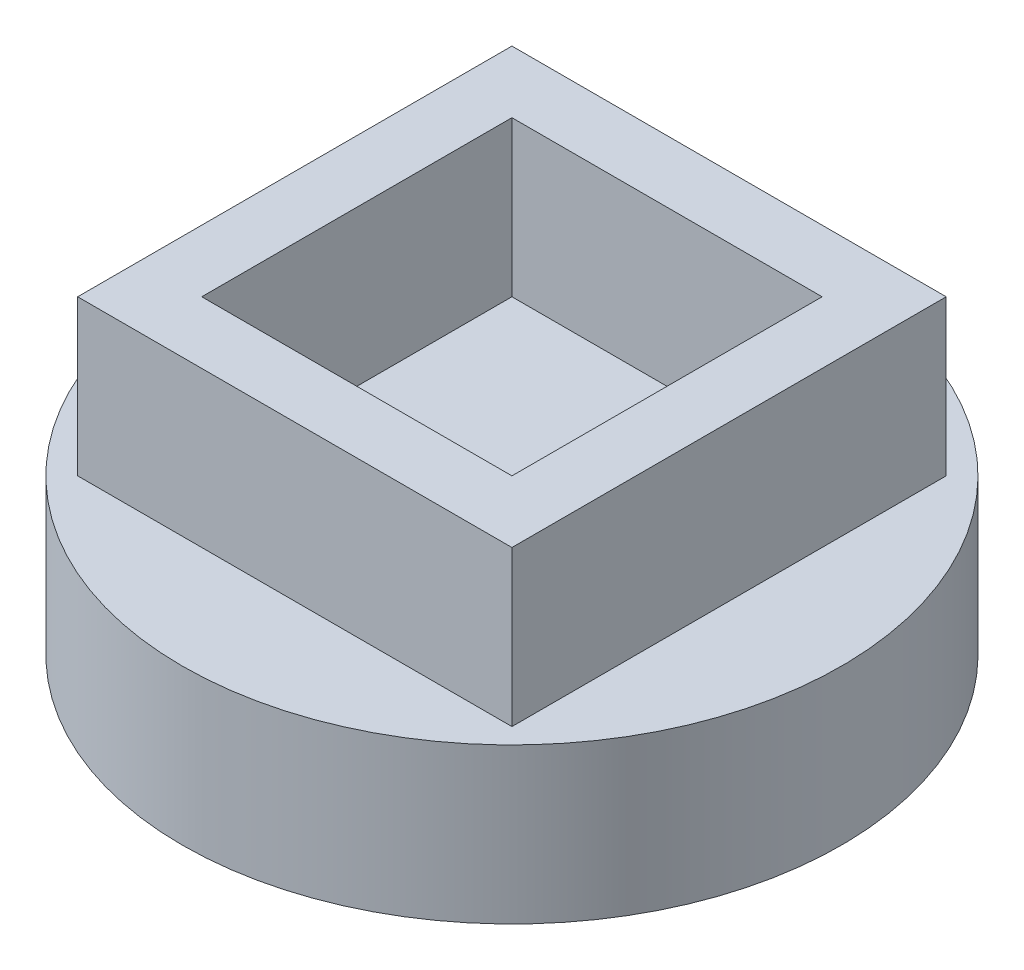
from build123d import *

# Parameters (mm, degrees)
ESQUISSE1_R        = 4.25
BOSS_EXTRU_1_DEPTH = 2
ESQUISSE2_W        = 5.6
ESQUISSE2_H        = 5.6
ESQUISSE2_W_2      = 4
ESQUISSE2_H_2      = 4
BOSS_EXTRU_2_DEPTH = 2


with BuildPart() as part:
    # Esquisse1 → Boss.-Extru.1 (new body)
    with BuildSketch(Plane(origin=(0, 0, 0), x_dir=(1, 0, 0), z_dir=(0, 1, 0))):
        with Locations(Location((0, 0, 0), (0, 0, 270))):
            Circle(ESQUISSE1_R)
    extrude(amount=BOSS_EXTRU_1_DEPTH)

    # Esquisse2 → Boss.-Extru.2 (add)
    with BuildSketch(Plane(origin=(0, 2, 0), x_dir=(1, 0, 0), z_dir=(0, 1, 0))):
        Rectangle(ESQUISSE2_W, ESQUISSE2_H)
        Rectangle(ESQUISSE2_W_2, ESQUISSE2_H_2, mode=Mode.SUBTRACT)
    extrude(amount=BOSS_EXTRU_2_DEPTH)


solid = part.part
